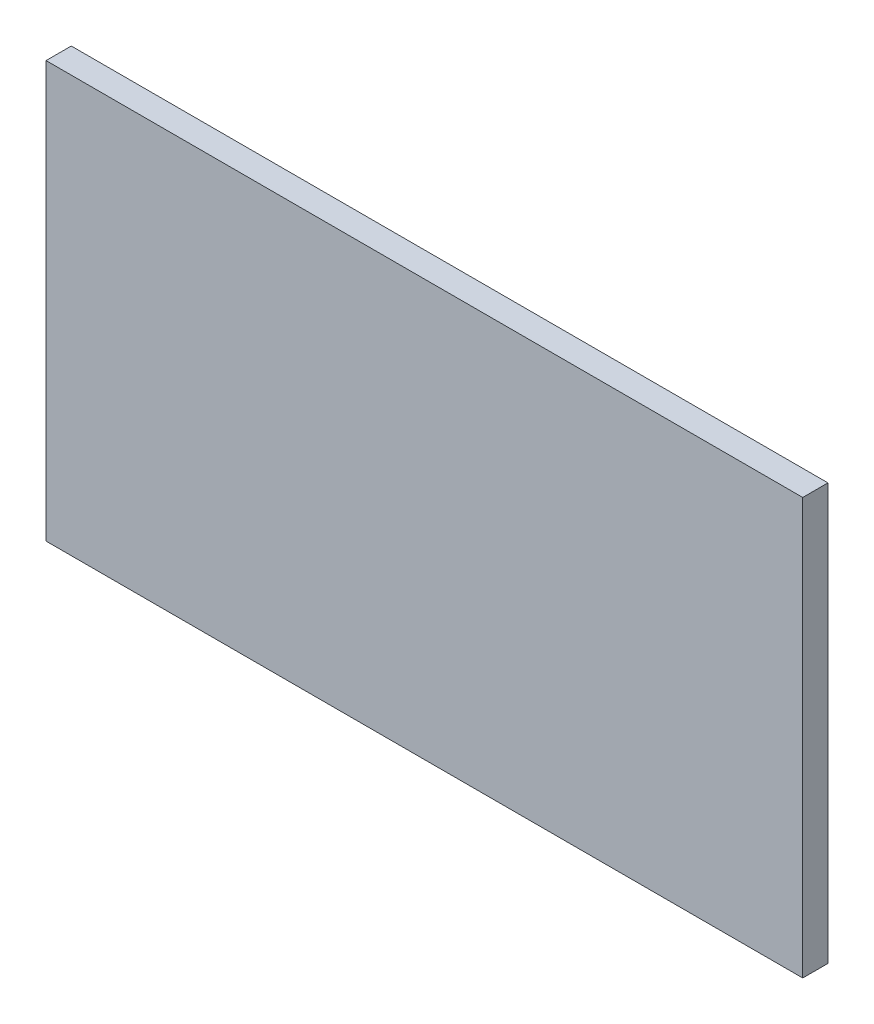
from build123d import *

# Parameters (mm, degrees)
SKETCH_1_W      = 300
SKETCH_1_H      = 165
EXTRUDE_1_DEPTH = 10


with BuildPart() as part:
    # 스케치1 → 보스-돌출1 (new body)
    with BuildSketch(Plane.XY):
        with Locations((150, 82.5)):
            Rectangle(SKETCH_1_W, SKETCH_1_H)
    extrude(amount=EXTRUDE_1_DEPTH)


solid = part.part
